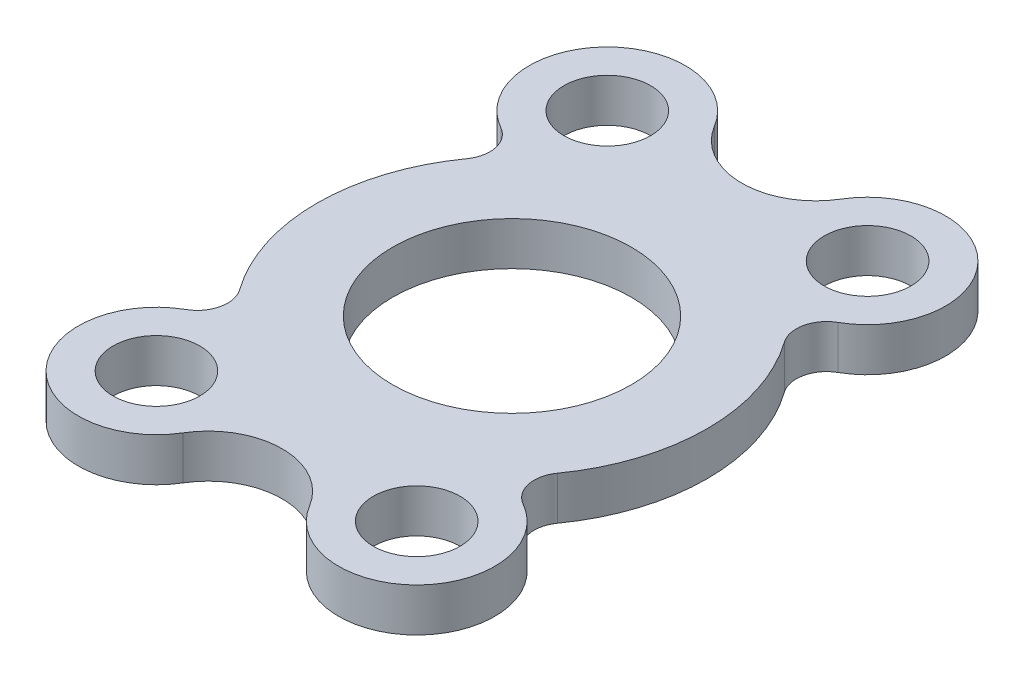
from build123d import *

# Parameters (mm, degrees)
SKETCH_1_R      = 27.5
SKETCH_1_R_2    = 10
EXTRUDE_1_DEPTH = 10


with BuildPart() as part:
    # Эскиз1 → Бобышка-Вытянуть1 (new body)
    with BuildSketch(Plane(origin=(0, 0, 0), x_dir=(1, 0, 0), z_dir=(0, 1, 0))):
        with BuildLine():
            ThreePointArc((36.626693786, -26.14355183), (45, 0), (36.626693786, 26.14355183))
            ThreePointArc((36.626693786, 26.14355183), (35.489388485, 31.722157226), (38.87340923, 36.300661906))
            ThreePointArc((38.87340923, 36.300661906), (42.889809267, 64.52547333), (14.571428571, 61.232941793))
            ThreePointArc((14.571428571, 61.232941793), (0, 52.989280604), (-14.571428571, 61.232941793))
            ThreePointArc((-14.571428571, 61.232941793), (-42.889809267, 64.52547333), (-38.87340923, 36.300661906))
            ThreePointArc((-38.87340923, 36.300661906), (-35.489388485, 31.722157226), (-36.626693786, 26.14355183))
            ThreePointArc((-36.626693786, 26.14355183), (-45, 0), (-36.626693786, -26.14355183))
            ThreePointArc((-36.626693786, -26.14355183), (-35.489388485, -31.722157226), (-38.87340923, -36.300661906))
            ThreePointArc((-38.87340923, -36.300661906), (-42.889809267, -64.52547333), (-14.571428571, -61.232941793))
            ThreePointArc((-14.571428571, -61.232941793), (0, -52.989280604), (14.571428571, -61.232941793))
            ThreePointArc((14.571428571, -61.232941793), (42.889809267, -64.52547333), (38.87340923, -36.300661906))
            ThreePointArc((38.87340923, -36.300661906), (35.489388485, -31.722157226), (36.626693786, -26.14355183))
        make_face()
        Circle(SKETCH_1_R, mode=Mode.SUBTRACT)
        with Locations((30, -51.961524227)):
            Circle(SKETCH_1_R_2, mode=Mode.SUBTRACT)
        with Locations((-30, -51.961524227)):
            Circle(SKETCH_1_R_2, mode=Mode.SUBTRACT)
        with Locations((-30, 51.961524227)):
            Circle(SKETCH_1_R_2, mode=Mode.SUBTRACT)
        with Locations((30, 51.961524227)):
            Circle(SKETCH_1_R_2, mode=Mode.SUBTRACT)
    extrude(amount=EXTRUDE_1_DEPTH)


solid = part.part
